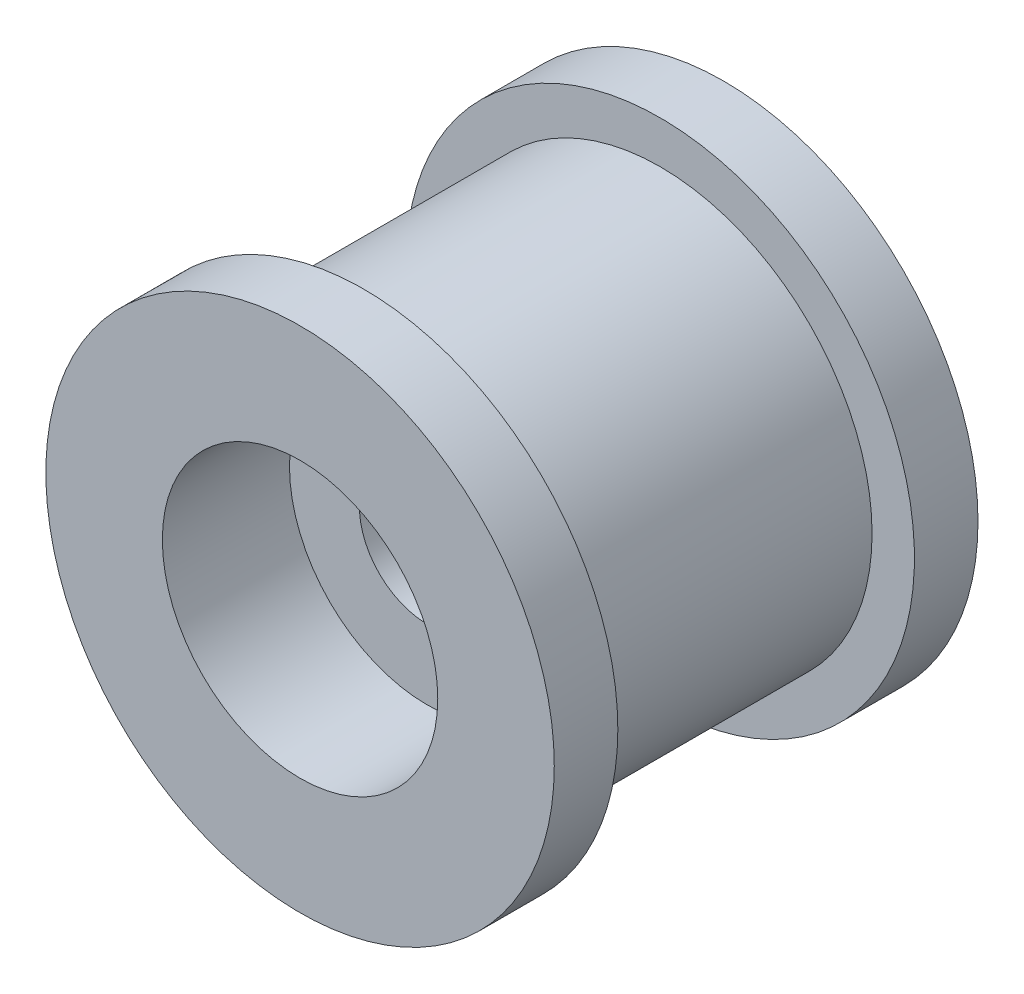
from build123d import *

# Parameters (mm, degrees)
SKETCH1_R           = 6
SKETCH1_R_2         = 1.6
BOSS_EXTRUDE1_DEPTH = 10
SKETCH2_W           = 1.332407761
SKETCH2_H           = 7
SKETCH4_R           = 3.25
CUT_EXTRUDE1_DEPTH  = 3


with BuildPart() as part:
    # Sketch1 → Boss-Extrude1 (new body)
    with BuildSketch(Plane.XY):
        Circle(SKETCH1_R)
        Circle(SKETCH1_R_2, mode=Mode.SUBTRACT)
    extrude(amount=BOSS_EXTRUDE1_DEPTH)

    # Sketch2 → Cut-Revolve1 (revolve, cut)
    with BuildSketch(Plane(origin=(0, 0, 0), x_dir=(1, 0, 0), z_dir=(0, 1, 0))):
        with Locations((-5.666203881, -5)):
            Rectangle(SKETCH2_W, SKETCH2_H)
    revolve(axis=Axis((0, 0, 0), (0, 0, 1)), mode=Mode.SUBTRACT)

    # Sketch4 → Cut-Extrude1 (cut)
    with BuildSketch(Plane.XY.offset(10)):
        Circle(SKETCH4_R)
    extrude(amount=-CUT_EXTRUDE1_DEPTH, mode=Mode.SUBTRACT)


solid = part.part
